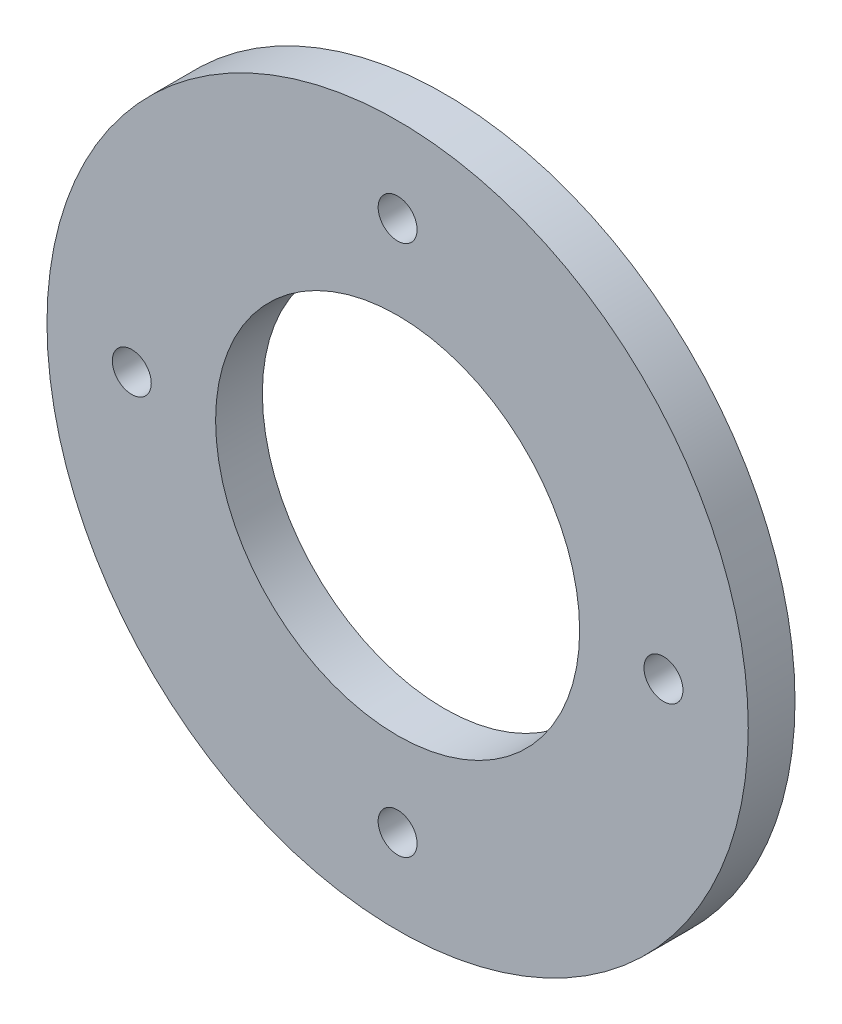
from build123d import *

# Parameters (mm, degrees)
CROQUIS1_R              = 22.5
CROQUIS1_R_2            = 11.68
CROQUIS1_R_3            = 1.25
SALIENTE_EXTRUIR1_DEPTH = 3


with BuildPart() as part:
    # Croquis1 → Saliente-Extruir1 (new body)
    with BuildSketch(Plane.XY):
        Circle(CROQUIS1_R)
        Circle(CROQUIS1_R_2, mode=Mode.SUBTRACT)
        with Locations((-17.05777305, 0)):
            Circle(CROQUIS1_R_3, mode=Mode.SUBTRACT)
        with Locations((0, 17.05777305)):
            Circle(CROQUIS1_R_3, mode=Mode.SUBTRACT)
        with Locations((17.05777305, 0)):
            Circle(CROQUIS1_R_3, mode=Mode.SUBTRACT)
        with Locations((0, -17.05777305)):
            Circle(CROQUIS1_R_3, mode=Mode.SUBTRACT)
    extrude(amount=SALIENTE_EXTRUIR1_DEPTH)


solid = part.part
